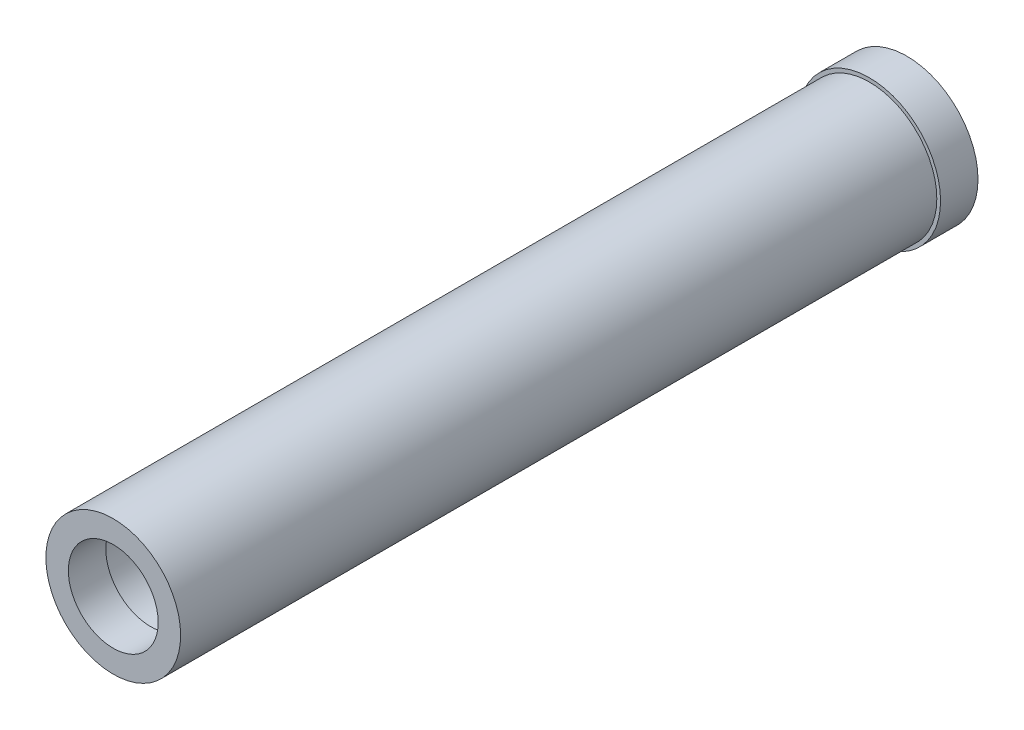
from build123d import *

# Parameters (mm, degrees)
SKETCH1_R           = 19
BOSS_EXTRUDE2_DEPTH = 10
SKETCH2_R           = 18
BOSS_EXTRUDE3_DEPTH = 202
SKETCH3_R           = 13
CUT_EXTRUDE1_DEPTH  = 200
SKETCH4_R           = 13
SKETCH4_R_2         = 12
BOSS_EXTRUDE4_DEPTH = 10


with BuildPart() as part:
    # Sketch1 → Boss-Extrude2 (new body)
    with BuildSketch(Plane.XY):
        Circle(SKETCH1_R)
    extrude(amount=BOSS_EXTRUDE2_DEPTH)

    # Sketch2 → Boss-Extrude3 (add)
    with BuildSketch(Plane.XY.offset(10)):
        Circle(SKETCH2_R)
    extrude(amount=BOSS_EXTRUDE3_DEPTH)

    # Sketch3 → Cut-Extrude1 (cut)
    with BuildSketch(Plane.XY.offset(212)):
        Circle(SKETCH3_R)
    extrude(amount=-CUT_EXTRUDE1_DEPTH, mode=Mode.SUBTRACT)

    # Sketch4 → Boss-Extrude4 (add)
    with BuildSketch(Plane.XY.offset(212)):
        Circle(SKETCH4_R)
        Circle(SKETCH4_R_2, mode=Mode.SUBTRACT)
    extrude(amount=-BOSS_EXTRUDE4_DEPTH)


solid = part.part
